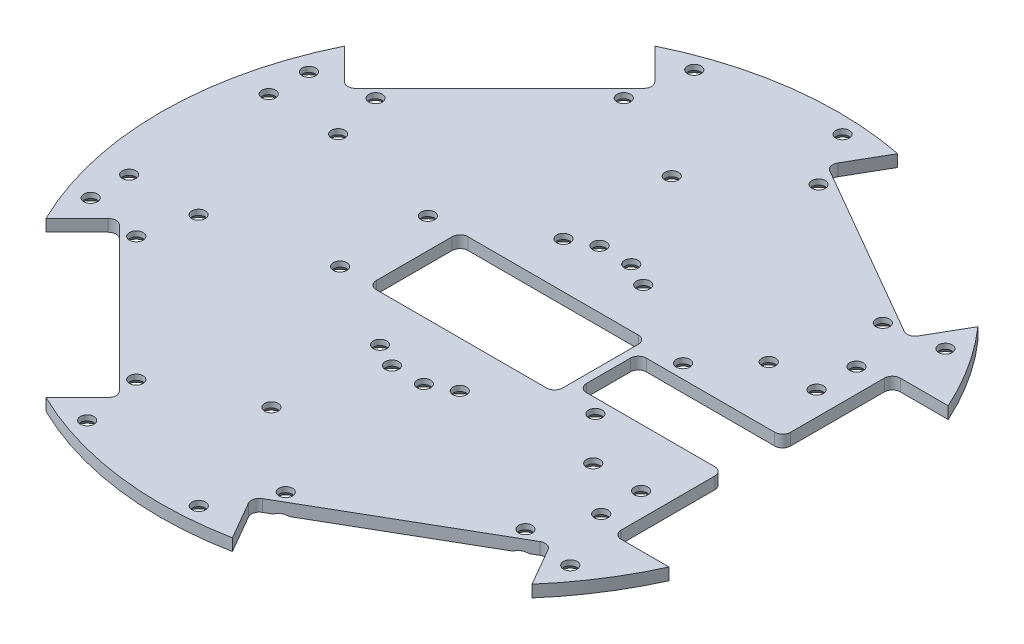
from build123d import *

# Parameters (mm, degrees)
ESBO_O1_R                            = 1.7
ESBO_O1_R_2                          = 1.5
BASE_DEPTH                           = 3
ESBO_O21_R                           = 1.5
BOCA_CHUTE_DEPTH                     = 20
ESBO_O32_W                           = 15
ESBO_O32_H                           = 3
CORTE_EXTRUS_O2_DEPTH                = 36.19
ESBO_O33_W                           = 46.7
ESBO_O33_H                           = 23
CORTE_EXTRUS_O3_DEPTH                = 121.245582039
ESCAREADO_PARA_SFHCS_M31_AT_2_COUNT  = 2
ESCAREADO_PARA_SFHCS_M31_AT_2_PITCH  = 16.685841485
ESCAREADO_PARA_SFHCS_M31_AT_3_COUNT  = 2
ESCAREADO_PARA_SFHCS_M31_AT_3_PITCH  = 26.055205041
ESCAREADO_PARA_SFHCS_M31_AT_4_COUNT  = 2
ESCAREADO_PARA_SFHCS_M31_AT_4_PITCH  = 13.637440316
ESCAREADO_PARA_SFHCS_M31_AT_5_COUNT  = 2
ESCAREADO_PARA_SFHCS_M31_AT_5_PITCH  = 31.577750597
ESCAREADO_PARA_SFHCS_M31_AT_6_COUNT  = 2
ESCAREADO_PARA_SFHCS_M31_AT_6_PITCH  = 46.701207559
ESCAREADO_PARA_SFHCS_M31_AT_7_COUNT  = 2
ESCAREADO_PARA_SFHCS_M31_AT_7_PITCH  = 55.221424698
ESCAREADO_PARA_SFHCS_M31_AT_8_COUNT  = 2
ESCAREADO_PARA_SFHCS_M31_AT_8_PITCH  = 68.331301379
ESCAREADO_PARA_SFHCS_M31_AT_9_COUNT  = 2
ESCAREADO_PARA_SFHCS_M31_AT_9_PITCH  = 71.833928112
ESCAREADO_PARA_SFHCS_M31_AT_10_COUNT = 2
ESCAREADO_PARA_SFHCS_M31_AT_10_PITCH = 69.001855552
ESCAREADO_PARA_SFHCS_M31_AT_11_COUNT = 2
ESCAREADO_PARA_SFHCS_M31_AT_11_PITCH = 61.430565004
ESCAREADO_PARA_SFHCS_M31_AT_12_COUNT = 2
ESCAREADO_PARA_SFHCS_M31_AT_12_PITCH = 57.028018756
ESCAREADO_PARA_SFHCS_M31_AT_13_COUNT = 2
ESCAREADO_PARA_SFHCS_M31_AT_13_PITCH = 75.637618321
ESCAREADO_PARA_SFHCS_M31_AT_14_COUNT = 2
ESCAREADO_PARA_SFHCS_M31_AT_14_PITCH = 96.525270503
ESCAREADO_PARA_SFHCS_M31_AT_15_COUNT = 2
ESCAREADO_PARA_SFHCS_M31_AT_15_PITCH = 95.765279894
ESCAREADO_PARA_SFHCS_M31_AT_16_COUNT = 2
ESCAREADO_PARA_SFHCS_M31_AT_16_PITCH = 100.405860436
ESCAREADO_PARA_SFHCS_M31_AT_17_COUNT = 2
ESCAREADO_PARA_SFHCS_M31_AT_17_PITCH = 126.981552798
ESCAREADO_PARA_SFHCS_M31_AT_18_COUNT = 2
ESCAREADO_PARA_SFHCS_M31_AT_18_PITCH = 126.222537613
ESCAREADO_PARA_SFHCS_M31_AT_19_COUNT = 2
ESCAREADO_PARA_SFHCS_M31_AT_19_PITCH = 143.196261927
ESCAREADO_PARA_SFHCS_M31_AT_20_COUNT = 2
ESCAREADO_PARA_SFHCS_M31_AT_20_PITCH = 141.271614857
ESCAREADO_PARA_SFHCS_M31_AT_21_COUNT = 2
ESCAREADO_PARA_SFHCS_M31_AT_21_PITCH = 65.192076785
ESCAREADO_PARA_SFHCS_M31_AT_22_COUNT = 2
ESCAREADO_PARA_SFHCS_M31_AT_22_PITCH = 71.660048206
ESCAREADO_PARA_SFHCS_M31_AT_23_COUNT = 2
ESCAREADO_PARA_SFHCS_M31_AT_23_PITCH = 69.403759883
ESCAREADO_PARA_SFHCS_M31_AT_24_COUNT = 2
ESCAREADO_PARA_SFHCS_M31_AT_24_PITCH = 79.355770361
ESCAREADO_PARA_SFHCS_M31_AT_25_COUNT = 2
ESCAREADO_PARA_SFHCS_M31_AT_25_PITCH = 94.045640367
ESCAREADO_PARA_SFHCS_M31_AT_26_COUNT = 2
ESCAREADO_PARA_SFHCS_M31_AT_26_PITCH = 92.800098367
ESCAREADO_PARA_SFHCS_M31_AT_27_COUNT = 2
ESCAREADO_PARA_SFHCS_M31_AT_27_PITCH = 124.953160826
ESCAREADO_PARA_SFHCS_M31_AT_28_COUNT = 2
ESCAREADO_PARA_SFHCS_M31_AT_28_PITCH = 140.887171602
ESCAREADO_PARA_SFHCS_M31_AT_29_COUNT = 2
ESCAREADO_PARA_SFHCS_M31_AT_29_PITCH = 120.82932396
ESCAREADO_PARA_SFHCS_M31_AT_30_COUNT = 2
ESCAREADO_PARA_SFHCS_M31_AT_30_PITCH = 87.05339959
ESCAREADO_PARA_SFHCS_M31_AT_31_COUNT = 2
ESCAREADO_PARA_SFHCS_M31_AT_31_PITCH = 93.08108087
ESCAREADO_PARA_SFHCS_M31_AT_32_COUNT = 2
ESCAREADO_PARA_SFHCS_M31_AT_32_PITCH = 98.24270644
ESCAREADO_PARA_SFHCS_M31_AT_33_COUNT = 2
ESCAREADO_PARA_SFHCS_M31_AT_33_PITCH = 100.235466588
ESCAREADO_PARA_SFHCS_M31_AT_34_COUNT = 2
ESCAREADO_PARA_SFHCS_M31_AT_34_PITCH = 143.756871864
ESCAREADO_PARA_SFHCS_M31_AT_35_COUNT = 2
ESCAREADO_PARA_SFHCS_M31_AT_35_PITCH = 153.728274182
ESCAREADO_PARA_SFHCS_M31_AT_36_COUNT = 2
ESCAREADO_PARA_SFHCS_M31_AT_36_PITCH = 110.228584759
ESCAREADO_PARA_SFHCS_M31_AT_37_COUNT = 2
ESCAREADO_PARA_SFHCS_M31_AT_37_PITCH = 138.649653495
ESCAREADO_PARA_SFHCS_M31_AT_38_COUNT = 2
ESCAREADO_PARA_SFHCS_M31_AT_38_PITCH = 154.262007126
ESCAREADO_PARA_SFHCS_M31_AT_39_COUNT = 2
ESCAREADO_PARA_SFHCS_M31_AT_39_PITCH = 158.442890999
ESCAREADO_PARA_SFHCS_M31_AT_40_COUNT = 2
ESCAREADO_PARA_SFHCS_M31_AT_40_PITCH = 147.537577729
FILETE1_R                            = 2


with BuildPart() as part:
    # Esboço1 → Base (new body)
    with BuildSketch(Plane(origin=(0, 0, 0), x_dir=(1, 0, 0), z_dir=(0, 1, 0))):
        with BuildLine():
            Line((-67.124614158, -28.233741192), (-28.233741192, -67.124614158))
            Line((-28.233741192, -67.124614158), (-37.426129348, -76.317002313))
            ThreePointArc((-37.426129348, -76.317002313), (-11.094726339, -84.272813217), (16.398571251, -83.403158579))
            Line((16.398571251, -83.403158579), (9.898571251, -72.14482833))
            Line((9.898571251, -72.14482833), (57.529968459, -44.64482833))
            Line((57.529968459, -44.64482833), (64.029968459, -55.903158579))
            ThreePointArc((64.029968459, -55.903158579), (85, 0), (64.029968459, 55.903158579))
            Line((64.029968459, 55.903158579), (57.529968459, 44.64482833))
            Line((57.529968459, 44.64482833), (9.898571251, 72.14482833))
            Line((9.898571251, 72.14482833), (16.398571251, 83.403158579))
            ThreePointArc((16.398571251, 83.403158579), (-11.094726339, 84.272813217), (-37.426129348, 76.317002313))
            Line((-37.426129348, 76.317002313), (-28.233741192, 67.124614158))
            Line((-28.233741192, 67.124614158), (-67.124614158, 28.233741192))
            Line((-67.124614158, 28.233741192), (-76.317002313, 37.426129348))
            ThreePointArc((-76.317002313, 37.426129348), (-85, 0), (-76.317002313, -37.426129348))
            Line((-76.317002313, -37.426129348), (-67.124614158, -28.233741192))
        make_face()
        with Locations(Location((-61.114206518, -30.001508145, 0), (0, 0, 270))):
            Circle(ESBO_O1_R, mode=Mode.SUBTRACT)
        with Locations(Location((-30.001508145, -61.114206518, 0), (0, 0, 90))):
            Circle(ESBO_O1_R, mode=Mode.SUBTRACT)
        with Locations(Location((13.161710972, -66.796752118, 0), (0, 0, 270))):
            Circle(ESBO_O1_R, mode=Mode.SUBTRACT)
        with Locations(Location((51.266828739, -44.796752118, 0), (0, 0, 90))):
            Circle(ESBO_O1_R, mode=Mode.SUBTRACT)
        with Locations(Location((-61.114206518, 30.001508145, 0), (0, 0, 90))):
            Circle(ESBO_O1_R, mode=Mode.SUBTRACT)
        with Locations(Location((-30.001508145, 61.114206518, 0), (0, 0, 270))):
            Circle(ESBO_O1_R, mode=Mode.SUBTRACT)
        with Locations(Location((13.161710972, 66.796752118, 0), (0, 0, 90))):
            Circle(ESBO_O1_R, mode=Mode.SUBTRACT)
        with Locations(Location((51.266828739, 44.796752118, 0), (0, 0, 270))):
            Circle(ESBO_O1_R, mode=Mode.SUBTRACT)
        with Locations(Location((-75.398491, 17.5, 0), (0, 0, 270))):
            Circle(ESBO_O1_R_2, mode=Mode.SUBTRACT)
        with Locations(Location((-58, 17.5, 0), (0, 0, 270))):
            Circle(ESBO_O1_R_2, mode=Mode.SUBTRACT)
        with Locations(Location((-58, -17.5, 0), (0, 0, 90))):
            Circle(ESBO_O1_R_2, mode=Mode.SUBTRACT)
        with Locations(Location((-75.398491, -17.5, 0), (0, 0, 90))):
            Circle(ESBO_O1_R_2, mode=Mode.SUBTRACT)
        with Locations(Location((-27.317649341, 76.108017243, 0), (0, 0, 270))):
            Circle(ESBO_O1_R_2, mode=Mode.SUBTRACT)
        with Locations(Location((-75.175409663, 27.361611466, 0), (0, 0, 270))):
            Circle(ESBO_O1_R_2, mode=Mode.SUBTRACT)
        with Locations(Location((64.72135955, 47.022820183, 0), (0, 0, 270))):
            Circle(ESBO_O1_R_2, mode=Mode.SUBTRACT)
        with Locations(Location((64.72135955, -47.022820183, 0), (0, 0, 90))):
            Circle(ESBO_O1_R_2, mode=Mode.SUBTRACT)
        with Locations(Location((-75.175409663, -27.361611466, 0), (0, 0, 90))):
            Circle(ESBO_O1_R_2, mode=Mode.SUBTRACT)
        with Locations(Location((7, -26, 0), (0, 0, 270))):
            Circle(ESBO_O1_R_2, mode=Mode.SUBTRACT)
        with Locations(Location((13, -23, 0), (0, 0, 270))):
            Circle(ESBO_O1_R_2, mode=Mode.SUBTRACT)
        with Locations(Location((35, -11, 0), (0, 0, 270))):
            Circle(ESBO_O1_R_2, mode=Mode.SUBTRACT)
        with Locations(Location((5.268571782, 80.705646294, 0), (0, 0, 270))):
            Circle(ESBO_O1_R_2, mode=Mode.SUBTRACT)
        with Locations(Location((-7.042875224, 50.186336462, 0), (0, 0, 270))):
            Circle(ESBO_O1_R_2, mode=Mode.SUBTRACT)
        with Locations(Location((-27.317649341, -76.108017243, 0), (0, 0, 90))):
            Circle(ESBO_O1_R_2, mode=Mode.SUBTRACT)
        with Locations(Location((5.268571782, -80.705646294, 0), (0, 0, 90))):
            Circle(ESBO_O1_R_2, mode=Mode.SUBTRACT)
        with Locations(Location((-7.042875224, -50.186336462, 0), (0, 0, 90))):
            Circle(ESBO_O1_R_2, mode=Mode.SUBTRACT)
        with Locations(Location((-29, -11, 0), (0, 0, 90))):
            Circle(ESBO_O1_R_2, mode=Mode.SUBTRACT)
        with Locations(Location((-7, -23, 0), (0, 0, 90))):
            Circle(ESBO_O1_R_2, mode=Mode.SUBTRACT)
        with Locations(Location((-1, -26, 0), (0, 0, 90))):
            Circle(ESBO_O1_R_2, mode=Mode.SUBTRACT)
        with Locations(Location((35, 11, 0), (0, 0, 90))):
            Circle(ESBO_O1_R_2, mode=Mode.SUBTRACT)
        with Locations(Location((13, 23, 0), (0, 0, 90))):
            Circle(ESBO_O1_R_2, mode=Mode.SUBTRACT)
        with Locations(Location((7, 26, 0), (0, 0, 90))):
            Circle(ESBO_O1_R_2, mode=Mode.SUBTRACT)
        with Locations(Location((-1, 26, 0), (0, 0, 270))):
            Circle(ESBO_O1_R_2, mode=Mode.SUBTRACT)
        with Locations(Location((-7, 23, 0), (0, 0, 270))):
            Circle(ESBO_O1_R_2, mode=Mode.SUBTRACT)
        with Locations(Location((-29, 11, 0), (0, 0, 270))):
            Circle(ESBO_O1_R_2, mode=Mode.SUBTRACT)
    extrude(amount=BASE_DEPTH)

    # Esboço21 → Boca Chute (cut)
    with BuildSketch(Plane.XZ):
        with Locations(Location((57.459666924, 32, 0), (0, 0, 270))):
            Circle(ESBO_O21_R)
        with Locations(Location((57.459666924, 22, 0), (0, 0, 270))):
            Circle(ESBO_O21_R)
        with Locations(Location((45.459666924, 22, 0), (0, 0, 270))):
            Circle(ESBO_O21_R)
        with Locations(Location((45.459666924, -22, 0), (0, 0, 90))):
            Circle(ESBO_O21_R)
        with Locations(Location((57.459666924, -22, 0), (0, 0, 90))):
            Circle(ESBO_O21_R)
        with Locations(Location((57.459666924, -32, 0), (0, 0, 90))):
            Circle(ESBO_O21_R)
        with BuildLine():
            Line((63.459666924, -35), (77.459666924, -35))
            ThreePointArc((77.459666924, -35), (85, 0), (77.459666924, 35))
            Line((77.459666924, 35), (63.459666924, 35))
            Line((63.459666924, 35), (63.459666924, -35))
        make_face()
    extrude(amount=-BOCA_CHUTE_DEPTH, mode=Mode.SUBTRACT)

    # Esboço32 → Corte-extrusão2 (cut)
    with BuildSketch(Plane(origin=(63.459666924, 0, 0), x_dir=(0, 0, -1), z_dir=(1, 0, 0))):
        with Locations((0, 1.5)):
            Rectangle(ESBO_O32_W, ESBO_O32_H)
    extrude(amount=-CORTE_EXTRUS_O2_DEPTH, mode=Mode.SUBTRACT)

    # Esboço33 → Corte-extrusão3 (cut, through all)
    with BuildSketch(Plane(origin=(0, 3, 0), x_dir=(1, 0, 0), z_dir=(0, 1, 0))):
        with Locations((1.919666924, 0)):
            Rectangle(ESBO_O33_W, ESBO_O33_H)
    extrude(amount=-CORTE_EXTRUS_O3_DEPTH, mode=Mode.SUBTRACT)

    # Esboço35 → Escareado para SFHCS M31 (revolve, cut)
    with BuildSketch(Plane(origin=(64.72135955, 0, -47.022820183), x_dir=(0, 0, -1), z_dir=(1, 0, 0))):
        Polygon((0, 0), (0, 3), (1.7, 3), (1.7, 1.66), (3.36, 0), align=None)
    escareado_para_sfhcs_m31 = revolve(axis=Axis((64.72135955, -6.35, -47.022820183), (0, 1, 0)), mode=Mode.SUBTRACT)

    # Escareado para SFHCS M31 at 2: Escareado para SFHCS M31 ×2
    with Locations(*[Vector(-0.4352008637067738, 0, 0.9003333872676711) * (i * ESCAREADO_PARA_SFHCS_M31_AT_2_PITCH) for i in range(1, ESCAREADO_PARA_SFHCS_M31_AT_2_COUNT)]):
        add(escareado_para_sfhcs_m31, mode=Mode.SUBTRACT)

    # Escareado para SFHCS M31 at 3: Escareado para SFHCS M31 ×2
    with Locations(*[Vector(-0.2787041059339539, 0, 0.9603770204120647) * (i * ESCAREADO_PARA_SFHCS_M31_AT_3_PITCH) for i in range(1, ESCAREADO_PARA_SFHCS_M31_AT_3_COUNT)]):
        add(escareado_para_sfhcs_m31, mode=Mode.SUBTRACT)

    # Escareado para SFHCS M31 at 4: Escareado para SFHCS M31 ×2
    with Locations(*[Vector(-0.9865876952829133, 0, 0.16323210320384116) * (i * ESCAREADO_PARA_SFHCS_M31_AT_4_PITCH) for i in range(1, ESCAREADO_PARA_SFHCS_M31_AT_4_COUNT)]):
        add(escareado_para_sfhcs_m31, mode=Mode.SUBTRACT)

    # Escareado para SFHCS M31 at 5: Escareado para SFHCS M31 ×2
    with Locations(*[Vector(-0.6099767165777887, 0, 0.7924193367359104) * (i * ESCAREADO_PARA_SFHCS_M31_AT_5_PITCH) for i in range(1, ESCAREADO_PARA_SFHCS_M31_AT_5_COUNT)]):
        add(escareado_para_sfhcs_m31, mode=Mode.SUBTRACT)

    # Escareado para SFHCS M31 at 6: Escareado para SFHCS M31 ×2
    with Locations(*[Vector(-0.6364152257191596, 0, 0.7713466538935857) * (i * ESCAREADO_PARA_SFHCS_M31_AT_6_PITCH) for i in range(1, ESCAREADO_PARA_SFHCS_M31_AT_6_COUNT)]):
        add(escareado_para_sfhcs_m31, mode=Mode.SUBTRACT)

    # Escareado para SFHCS M31 at 7: Escareado para SFHCS M31 ×2
    with Locations(*[Vector(-0.9336892132027962, 0, -0.35808442181801703) * (i * ESCAREADO_PARA_SFHCS_M31_AT_7_PITCH) for i in range(1, ESCAREADO_PARA_SFHCS_M31_AT_7_COUNT)]):
        add(escareado_para_sfhcs_m31, mode=Mode.SUBTRACT)

    # Escareado para SFHCS M31 at 8: Escareado para SFHCS M31 ×2
    with Locations(*[Vector(-0.8700666688294272, 0, -0.49293406434538883) * (i * ESCAREADO_PARA_SFHCS_M31_AT_8_PITCH) for i in range(1, ESCAREADO_PARA_SFHCS_M31_AT_8_COUNT)]):
        add(escareado_para_sfhcs_m31, mode=Mode.SUBTRACT)

    # Escareado para SFHCS M31 at 9: Escareado para SFHCS M31 ×2
    with Locations(*[Vector(-0.9990297991568213, 0, -0.04403930513395204) * (i * ESCAREADO_PARA_SFHCS_M31_AT_9_PITCH) for i in range(1, ESCAREADO_PARA_SFHCS_M31_AT_9_COUNT)]):
        add(escareado_para_sfhcs_m31, mode=Mode.SUBTRACT)

    # Escareado para SFHCS M31 at 10: Escareado para SFHCS M31 ×2
    with Locations(*[Vector(-0.9524578581927121, 0, 0.30467036017136856) * (i * ESCAREADO_PARA_SFHCS_M31_AT_10_PITCH) for i in range(1, ESCAREADO_PARA_SFHCS_M31_AT_10_COUNT)]):
        add(escareado_para_sfhcs_m31, mode=Mode.SUBTRACT)

    # Escareado para SFHCS M31 at 11: Escareado para SFHCS M31 ×2
    with Locations(*[Vector(-0.9396195451862507, 0, 0.3422208501888561) * (i * ESCAREADO_PARA_SFHCS_M31_AT_11_PITCH) for i in range(1, ESCAREADO_PARA_SFHCS_M31_AT_11_COUNT)]):
        add(escareado_para_sfhcs_m31, mode=Mode.SUBTRACT)

    # Escareado para SFHCS M31 at 12: Escareado para SFHCS M31 ×2
    with Locations(*[Vector(-0.9069464568120339, 0, 0.4212459192396973) * (i * ESCAREADO_PARA_SFHCS_M31_AT_12_PITCH) for i in range(1, ESCAREADO_PARA_SFHCS_M31_AT_12_COUNT)]):
        add(escareado_para_sfhcs_m31, mode=Mode.SUBTRACT)

    # Escareado para SFHCS M31 at 13: Escareado para SFHCS M31 ×2
    with Locations(*[Vector(-0.9482233991778616, 0, 0.3176041329258513) * (i * ESCAREADO_PARA_SFHCS_M31_AT_13_PITCH) for i in range(1, ESCAREADO_PARA_SFHCS_M31_AT_13_COUNT)]):
        add(escareado_para_sfhcs_m31, mode=Mode.SUBTRACT)

    # Escareado para SFHCS M31 at 14: Escareado para SFHCS M31 ×2
    with Locations(*[Vector(-0.9535224134733126, 0, -0.30132209843293795) * (i * ESCAREADO_PARA_SFHCS_M31_AT_14_PITCH) for i in range(1, ESCAREADO_PARA_SFHCS_M31_AT_14_COUNT)]):
        add(escareado_para_sfhcs_m31, mode=Mode.SUBTRACT)

    # Escareado para SFHCS M31 at 15: Escareado para SFHCS M31 ×2
    with Locations(*[Vector(-0.9891149255745378, 0, -0.1471450441084455) * (i * ESCAREADO_PARA_SFHCS_M31_AT_15_PITCH) for i in range(1, ESCAREADO_PARA_SFHCS_M31_AT_15_COUNT)]):
        add(escareado_para_sfhcs_m31, mode=Mode.SUBTRACT)

    # Escareado para SFHCS M31 at 16: Escareado para SFHCS M31 ×2
    with Locations(*[Vector(-0.9334251919475125, 0, 0.3587720878743907) * (i * ESCAREADO_PARA_SFHCS_M31_AT_16_PITCH) for i in range(1, ESCAREADO_PARA_SFHCS_M31_AT_16_COUNT)]):
        add(escareado_para_sfhcs_m31, mode=Mode.SUBTRACT)

    # Escareado para SFHCS M31 at 17: Escareado para SFHCS M31 ×2
    with Locations(*[Vector(-0.9909751715474716, 0, 0.13404554963317217) * (i * ESCAREADO_PARA_SFHCS_M31_AT_17_PITCH) for i in range(1, ESCAREADO_PARA_SFHCS_M31_AT_17_COUNT)]):
        add(escareado_para_sfhcs_m31, mode=Mode.SUBTRACT)

    # Escareado para SFHCS M31 at 18: Escareado para SFHCS M31 ×2
    with Locations(*[Vector(-0.972261862826646, 0, 0.2338949980073545) * (i * ESCAREADO_PARA_SFHCS_M31_AT_18_PITCH) for i in range(1, ESCAREADO_PARA_SFHCS_M31_AT_18_COUNT)]):
        add(escareado_para_sfhcs_m31, mode=Mode.SUBTRACT)

    # Escareado para SFHCS M31 at 19: Escareado para SFHCS M31 ×2
    with Locations(*[Vector(-0.9785161195190776, 0, 0.2061703272571644) * (i * ESCAREADO_PARA_SFHCS_M31_AT_19_PITCH) for i in range(1, ESCAREADO_PARA_SFHCS_M31_AT_19_COUNT)]):
        add(escareado_para_sfhcs_m31, mode=Mode.SUBTRACT)

    # Escareado para SFHCS M31 at 20: Escareado para SFHCS M31 ×2
    with Locations(*[Vector(-0.9902680687415707, 0, 0.13917310096006244) * (i * ESCAREADO_PARA_SFHCS_M31_AT_20_PITCH) for i in range(1, ESCAREADO_PARA_SFHCS_M31_AT_20_COUNT)]):
        add(escareado_para_sfhcs_m31, mode=Mode.SUBTRACT)

    # Escareado para SFHCS M31 at 21: Escareado para SFHCS M31 ×2
    with Locations(*[Vector(-0.45590447514101445, 0, 0.8900287127651536) * (i * ESCAREADO_PARA_SFHCS_M31_AT_21_PITCH) for i in range(1, ESCAREADO_PARA_SFHCS_M31_AT_21_COUNT)]):
        add(escareado_para_sfhcs_m31, mode=Mode.SUBTRACT)

    # Escareado para SFHCS M31 at 22: Escareado para SFHCS M31 ×2
    with Locations(*[Vector(-0.26879262724585273, 0, 0.9631980707716726) * (i * ESCAREADO_PARA_SFHCS_M31_AT_22_PITCH) for i in range(1, ESCAREADO_PARA_SFHCS_M31_AT_22_COUNT)]):
        add(escareado_para_sfhcs_m31, mode=Mode.SUBTRACT)

    # Escareado para SFHCS M31 at 23: Escareado para SFHCS M31 ×2
    with Locations(*[Vector(-0.10462967190993586, 0, 0.9945112527045731) * (i * ESCAREADO_PARA_SFHCS_M31_AT_23_PITCH) for i in range(1, ESCAREADO_PARA_SFHCS_M31_AT_23_COUNT)]):
        add(escareado_para_sfhcs_m31, mode=Mode.SUBTRACT)

    # Escareado para SFHCS M31 at 24: Escareado para SFHCS M31 ×2
    with Locations(*[Vector(-0.0915080603823351, 0, 0.9958043356428325) * (i * ESCAREADO_PARA_SFHCS_M31_AT_24_PITCH) for i in range(1, ESCAREADO_PARA_SFHCS_M31_AT_24_COUNT)]):
        add(escareado_para_sfhcs_m31, mode=Mode.SUBTRACT)

    # Escareado para SFHCS M31 at 25: Escareado para SFHCS M31 ×2
    with Locations(*[(0, 0, i * ESCAREADO_PARA_SFHCS_M31_AT_25_PITCH) for i in range(1, ESCAREADO_PARA_SFHCS_M31_AT_25_COUNT)]):
        add(escareado_para_sfhcs_m31, mode=Mode.SUBTRACT)

    # Escareado para SFHCS M31 at 26: Escareado para SFHCS M31 ×2
    with Locations(*[Vector(-0.14498401454384457, 0, 0.9894339975595898) * (i * ESCAREADO_PARA_SFHCS_M31_AT_26_PITCH) for i in range(1, ESCAREADO_PARA_SFHCS_M31_AT_26_COUNT)]):
        add(escareado_para_sfhcs_m31, mode=Mode.SUBTRACT)

    # Escareado para SFHCS M31 at 27: Escareado para SFHCS M31 ×2
    with Locations(*[Vector(-0.4126318072873952, 0, 0.9108979040566171) * (i * ESCAREADO_PARA_SFHCS_M31_AT_27_PITCH) for i in range(1, ESCAREADO_PARA_SFHCS_M31_AT_27_COUNT)]):
        add(escareado_para_sfhcs_m31, mode=Mode.SUBTRACT)

    # Escareado para SFHCS M31 at 28: Escareado para SFHCS M31 ×2
    with Locations(*[Vector(-0.4219886529886094, 0, 0.9066011122587811) * (i * ESCAREADO_PARA_SFHCS_M31_AT_28_PITCH) for i in range(1, ESCAREADO_PARA_SFHCS_M31_AT_28_COUNT)]):
        add(escareado_para_sfhcs_m31, mode=Mode.SUBTRACT)

    # Escareado para SFHCS M31 at 29: Escareado para SFHCS M31 ×2
    with Locations(*[Vector(-0.5939306157021539, 0, 0.8045162669155053) * (i * ESCAREADO_PARA_SFHCS_M31_AT_29_PITCH) for i in range(1, ESCAREADO_PARA_SFHCS_M31_AT_29_COUNT)]):
        add(escareado_para_sfhcs_m31, mode=Mode.SUBTRACT)

    # Escareado para SFHCS M31 at 30: Escareado para SFHCS M31 ×2
    with Locations(*[Vector(-0.5941337132579173, 0, 0.8043662914185048) * (i * ESCAREADO_PARA_SFHCS_M31_AT_30_PITCH) for i in range(1, ESCAREADO_PARA_SFHCS_M31_AT_30_COUNT)]):
        add(escareado_para_sfhcs_m31, mode=Mode.SUBTRACT)

    # Escareado para SFHCS M31 at 31: Escareado para SFHCS M31 ×2
    with Locations(*[Vector(-0.6201191371092247, 0, 0.7845076518370683) * (i * ESCAREADO_PARA_SFHCS_M31_AT_31_PITCH) for i in range(1, ESCAREADO_PARA_SFHCS_M31_AT_31_COUNT)]):
        add(escareado_para_sfhcs_m31, mode=Mode.SUBTRACT)

    # Escareado para SFHCS M31 at 32: Escareado para SFHCS M31 ×2
    with Locations(*[Vector(-0.6689693508209702, 0, 0.7432899889425187) * (i * ESCAREADO_PARA_SFHCS_M31_AT_32_PITCH) for i in range(1, ESCAREADO_PARA_SFHCS_M31_AT_32_COUNT)]):
        add(escareado_para_sfhcs_m31, mode=Mode.SUBTRACT)

    # Escareado para SFHCS M31 at 33: Escareado para SFHCS M31 ×2
    with Locations(*[Vector(-0.7155287643316391, 0, 0.6985832716391351) * (i * ESCAREADO_PARA_SFHCS_M31_AT_33_PITCH) for i in range(1, ESCAREADO_PARA_SFHCS_M31_AT_33_COUNT)]):
        add(escareado_para_sfhcs_m31, mode=Mode.SUBTRACT)

    # Escareado para SFHCS M31 at 34: Escareado para SFHCS M31 ×2
    with Locations(*[Vector(-0.6589101895934748, 0, 0.7522216176432921) * (i * ESCAREADO_PARA_SFHCS_M31_AT_34_PITCH) for i in range(1, ESCAREADO_PARA_SFHCS_M31_AT_34_COUNT)]):
        add(escareado_para_sfhcs_m31, mode=Mode.SUBTRACT)

    # Escareado para SFHCS M31 at 35: Escareado para SFHCS M31 ×2
    with Locations(*[Vector(-0.5987123018253212, 0, 0.8009641562785599) * (i * ESCAREADO_PARA_SFHCS_M31_AT_35_PITCH) for i in range(1, ESCAREADO_PARA_SFHCS_M31_AT_35_COUNT)]):
        add(escareado_para_sfhcs_m31, mode=Mode.SUBTRACT)

    # Escareado para SFHCS M31 at 36: Escareado para SFHCS M31 ×2
    with Locations(*[Vector(-0.8502455125868664, 0, 0.5263863299192875) * (i * ESCAREADO_PARA_SFHCS_M31_AT_36_PITCH) for i in range(1, ESCAREADO_PARA_SFHCS_M31_AT_36_COUNT)]):
        add(escareado_para_sfhcs_m31, mode=Mode.SUBTRACT)

    # Escareado para SFHCS M31 at 37: Escareado para SFHCS M31 ×2
    with Locations(*[Vector(-0.8851184006358117, 0, 0.4653658956733967) * (i * ESCAREADO_PARA_SFHCS_M31_AT_37_PITCH) for i in range(1, ESCAREADO_PARA_SFHCS_M31_AT_37_COUNT)]):
        add(escareado_para_sfhcs_m31, mode=Mode.SUBTRACT)

    # Escareado para SFHCS M31 at 38: Escareado para SFHCS M31 ×2
    with Locations(*[Vector(-0.9083237873046625, 0, 0.4182677341327137) * (i * ESCAREADO_PARA_SFHCS_M31_AT_38_PITCH) for i in range(1, ESCAREADO_PARA_SFHCS_M31_AT_38_COUNT)]):
        add(escareado_para_sfhcs_m31, mode=Mode.SUBTRACT)

    # Escareado para SFHCS M31 at 39: Escareado para SFHCS M31 ×2
    with Locations(*[Vector(-0.8829475928589281, 0, 0.4694715627858887) * (i * ESCAREADO_PARA_SFHCS_M31_AT_39_PITCH) for i in range(1, ESCAREADO_PARA_SFHCS_M31_AT_39_COUNT)]):
        add(escareado_para_sfhcs_m31, mode=Mode.SUBTRACT)

    # Escareado para SFHCS M31 at 40: Escareado para SFHCS M31 ×2
    with Locations(*[Vector(-0.8529051920521731, 0, 0.5220658324104783) * (i * ESCAREADO_PARA_SFHCS_M31_AT_40_PITCH) for i in range(1, ESCAREADO_PARA_SFHCS_M31_AT_40_COUNT)]):
        add(escareado_para_sfhcs_m31, mode=Mode.SUBTRACT)

    # Filete1
    filete1_edges = [part.edges().sort_by_distance(p)[0] for p in [
        (63.459666924, 1.5, -35),
        (63.459666924, 1.5, 35),
        (27.269666924, 1.5, -7.5),
        (27.269666924, 1.5, 7.5),
        (63.459666924, 1.5, -7.5),
        (63.459666924, 1.5, 7.5),
        (25.269666924, 1.5, -11.5),
        (25.269666924, 1.5, 11.5),
        (-21.430333076, 1.5, 11.5),
        (-21.430333076, 1.5, -11.5),
        (9.898571251, 1.5, -72.14482833),
        (57.529968459, 1.5, -44.64482833),
        (57.529968459, 1.5, 44.64482833),
        (9.898571251, 1.5, 72.14482833),
        (-28.233741192, 1.5, 67.124614158),
        (-67.124614158, 1.5, 28.233741192),
        (-67.124614158, 1.5, -28.233741192),
        (-28.233741192, 1.5, -67.124614158),
    ]]
    fillet(filete1_edges, radius=FILETE1_R)


solid = part.part
